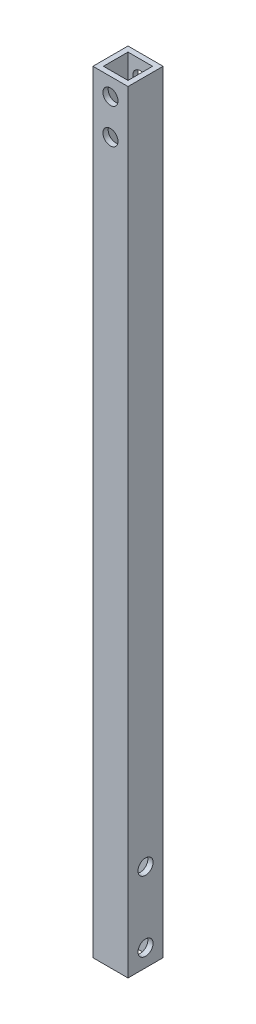
from build123d import *

# Parameters (mm, degrees)
SKETCH_1_W          = 10
SKETCH_1_H          = 10
SKETCH_1_W_2        = 7
SKETCH_1_H_2        = 7
EXTRUDE_1_DEPTH     = 220
SKETCH_2_R          = 2.15
CUT_EXTRUDE_1_DEPTH = 221.283907719
SKETCH_3_R          = 2.15
CUT_EXTRUDE_2_DEPTH = 221.283907719


with BuildPart() as part:
    # ｽｹｯﾁ1 → 押し出し-薄板1 (new body)
    with BuildSketch(Plane(origin=(0, 0, 0), x_dir=(1, 0, 0), z_dir=(0, 1, 0))):
        Rectangle(SKETCH_1_W, SKETCH_1_H)
        Rectangle(SKETCH_1_W_2, SKETCH_1_H_2, mode=Mode.SUBTRACT)
    extrude(amount=EXTRUDE_1_DEPTH)

    # ｽｹｯﾁ2 → ｶｯﾄ - 押し出し1 (cut, through all)
    with BuildSketch(Plane.XY.offset(5)):
        with Locations((0, 205)):
            Circle(SKETCH_2_R)
        with Locations((0, 215)):
            Circle(SKETCH_2_R)
    extrude(amount=-CUT_EXTRUDE_1_DEPTH, mode=Mode.SUBTRACT)

    # ｽｹｯﾁ3 → ｶｯﾄ - 押し出し2 (cut, through all)
    with BuildSketch(Plane(origin=(5, 0, 0), x_dir=(0, 0, -1), z_dir=(1, 0, 0))):
        with Locations((0, 5)):
            Circle(SKETCH_3_R)
        with Locations((0, 25)):
            Circle(SKETCH_3_R)
    extrude(amount=-CUT_EXTRUDE_2_DEPTH, mode=Mode.SUBTRACT)


solid = part.part
